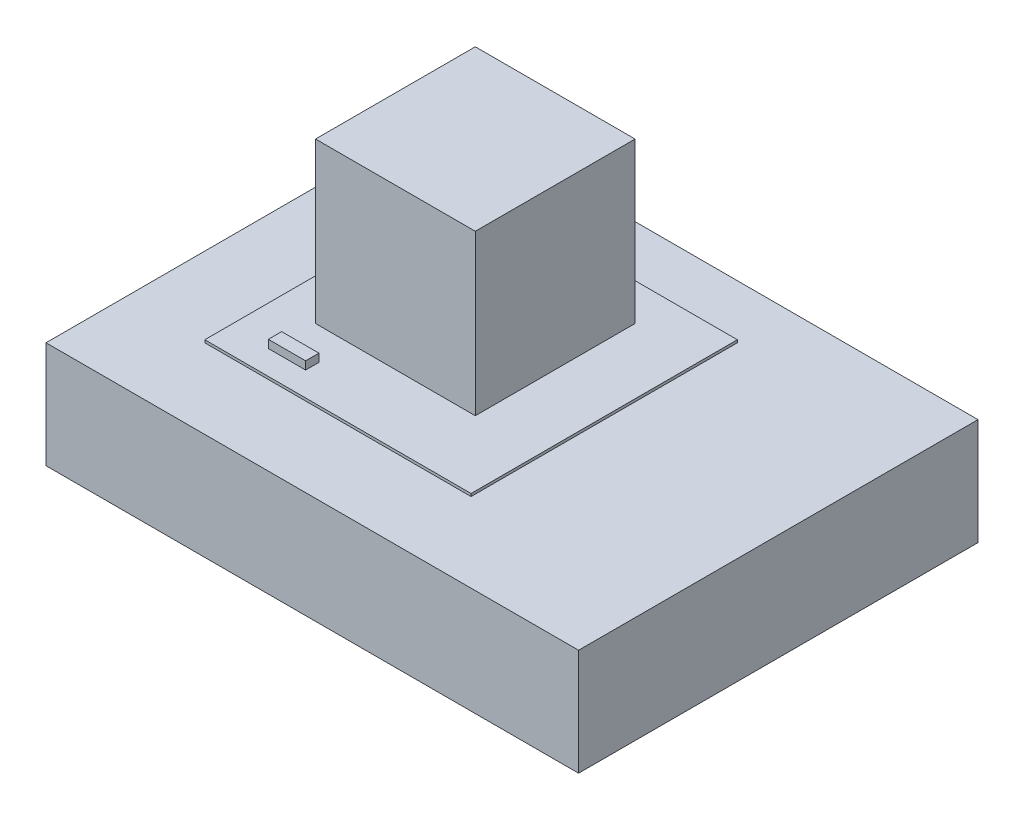
from build123d import *

# Parameters (mm, degrees)
SKETCH_10_W       = 200
SKETCH_10_H       = 150
EXTRUDE_401_DEPTH = 40
SKETCH_11_W       = 100
SKETCH_11_H       = 100
EXTRUDE_558_DEPTH = 1
SKETCH_12_W       = 60
SKETCH_12_H       = 60
EXTRUDE_709_DEPTH = 60
SKETCH_13_W       = 14
SKETCH_13_H       = 5
EXTRUDE_893_DEPTH = 3


with BuildPart() as part:
    # Эскиз10 → Extrude 401 (new body)
    with BuildSketch(Plane(origin=(0, 0, 0), x_dir=(1, 0, 0), z_dir=(0, 1, 0))):
        with Locations((50.389807825, -40.872183235)):
            Rectangle(SKETCH_10_W, SKETCH_10_H)
    extrude(amount=EXTRUDE_401_DEPTH)

    # Эскиз11 → Extrude 558 (add)
    with BuildSketch(Plane(origin=(0, 40, 0), x_dir=(1, 0, 0), z_dir=(0, 1, 0))):
        with Locations((30.223196857, -36.076377212)):
            Rectangle(SKETCH_11_W, SKETCH_11_H)
    extrude(amount=EXTRUDE_558_DEPTH)

    # Эскиз12 → Extrude 709 (add)
    with BuildSketch(Plane(origin=(0, 41, 0), x_dir=(1, 0, 0), z_dir=(0, 1, 0))):
        with Locations((25.734840207, -30)):
            Rectangle(SKETCH_12_W, SKETCH_12_H)
    extrude(amount=EXTRUDE_709_DEPTH)

    # Эскиз13 → Extrude 893 (add)
    with BuildSketch(Plane(origin=(0, 41, 0), x_dir=(1, 0, 0), z_dir=(0, 1, 0))):
        with Locations((2.012297913, -74.500076324)):
            Rectangle(SKETCH_13_W, SKETCH_13_H)
    extrude(amount=EXTRUDE_893_DEPTH)


solid = part.part
